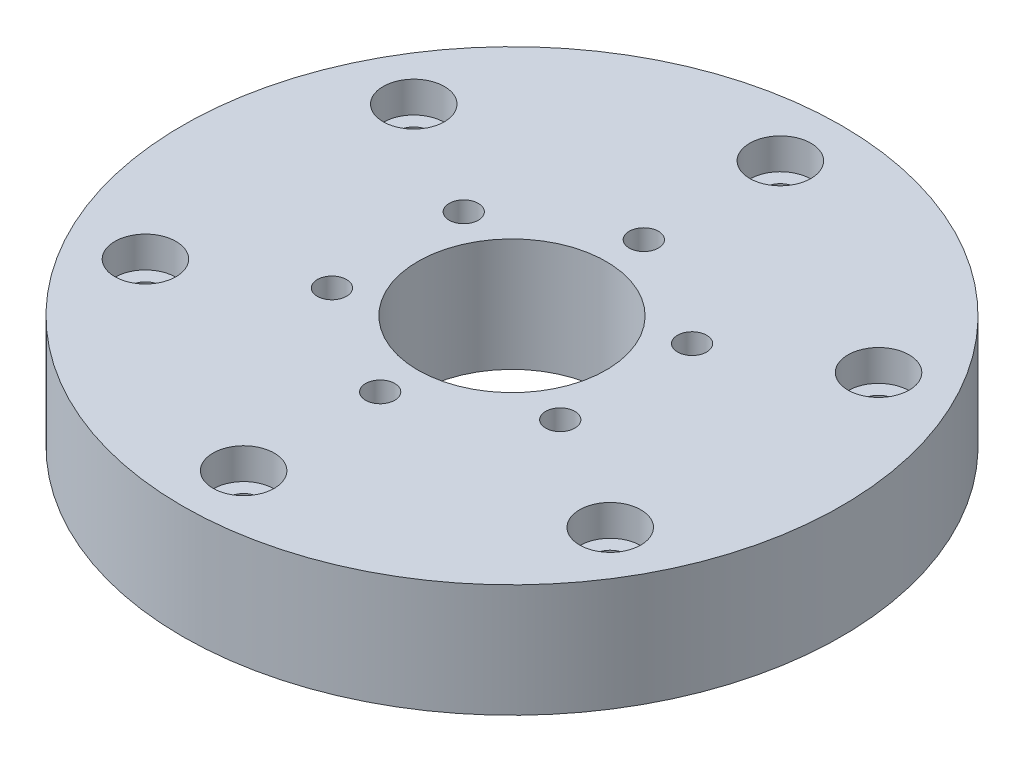
from build123d import *

# Parameters (mm, degrees)
SKETCH_1_R          = 35
SKETCH_1_R_2        = 10
SKETCH_1_R_3        = 1.55
SKETCH_1_R_4        = 1.7
EXTRUDE_1_DEPTH     = 12
SKETCH_2_R          = 3.25
CUT_EXTRUDE_1_DEPTH = 3.3


with BuildPart() as part:
    # 草图1 → 凸台-拉伸1 (new body)
    with BuildSketch(Plane(origin=(0, 0, 0), x_dir=(1, 0, 0), z_dir=(0, 1, 0))):
        with Locations(Location((0, 0, 0), (0, 0, 270))):
            Circle(SKETCH_1_R)
        with Locations(Location((0, 0, 0), (0, 0, 270))):
            Circle(SKETCH_1_R_2, mode=Mode.SUBTRACT)
        with Locations(Location((0, 14, 0), (0, 0, 270))):
            Circle(SKETCH_1_R_3, mode=Mode.SUBTRACT)
        with Locations(Location((12.124355653, 7, 0), (0, 0, 270))):
            Circle(SKETCH_1_R_3, mode=Mode.SUBTRACT)
        with Locations(Location((12.124355653, -7, 0), (0, 0, 270))):
            Circle(SKETCH_1_R_3, mode=Mode.SUBTRACT)
        with Locations(Location((0, -14, 0), (0, 0, 270))):
            Circle(SKETCH_1_R_3, mode=Mode.SUBTRACT)
        with Locations(Location((-12.124355653, -7, 0), (0, 0, 270))):
            Circle(SKETCH_1_R_3, mode=Mode.SUBTRACT)
        with Locations(Location((-12.124355653, 7, 0), (0, 0, 270))):
            Circle(SKETCH_1_R_3, mode=Mode.SUBTRACT)
        with Locations(Location((0, 28.5, 0), (0, 0, 270))):
            Circle(SKETCH_1_R_4, mode=Mode.SUBTRACT)
        with Locations(Location((24.681724008, 14.25, 0), (0, 0, 270))):
            Circle(SKETCH_1_R_4, mode=Mode.SUBTRACT)
        with Locations(Location((24.681724008, -14.25, 0), (0, 0, 270))):
            Circle(SKETCH_1_R_4, mode=Mode.SUBTRACT)
        with Locations(Location((0, -28.5, 0), (0, 0, 270))):
            Circle(SKETCH_1_R_4, mode=Mode.SUBTRACT)
        with Locations(Location((-24.681724008, -14.25, 0), (0, 0, 270))):
            Circle(SKETCH_1_R_4, mode=Mode.SUBTRACT)
        with Locations(Location((-24.681724008, 14.25, 0), (0, 0, 270))):
            Circle(SKETCH_1_R_4, mode=Mode.SUBTRACT)
    extrude(amount=EXTRUDE_1_DEPTH)

    # 草图2 → 切除-拉伸1 (cut)
    with BuildSketch(Plane(origin=(0, 12, 0), x_dir=(1, 0, 0), z_dir=(0, 1, 0))):
        with Locations(Location((0, 28.5, 0), (0, 0, 270))):
            Circle(SKETCH_2_R)
        with Locations(Location((24.681724008, 14.25, 0), (0, 0, 270))):
            Circle(SKETCH_2_R)
        with Locations(Location((24.681724008, -14.25, 0), (0, 0, 270))):
            Circle(SKETCH_2_R)
        with Locations(Location((0, -28.5, 0), (0, 0, 270))):
            Circle(SKETCH_2_R)
        with Locations(Location((-24.681724008, -14.25, 0), (0, 0, 270))):
            Circle(SKETCH_2_R)
        with Locations(Location((-24.681724008, 14.25, 0), (0, 0, 270))):
            Circle(SKETCH_2_R)
    extrude(amount=-CUT_EXTRUDE_1_DEPTH, mode=Mode.SUBTRACT)


solid = part.part
